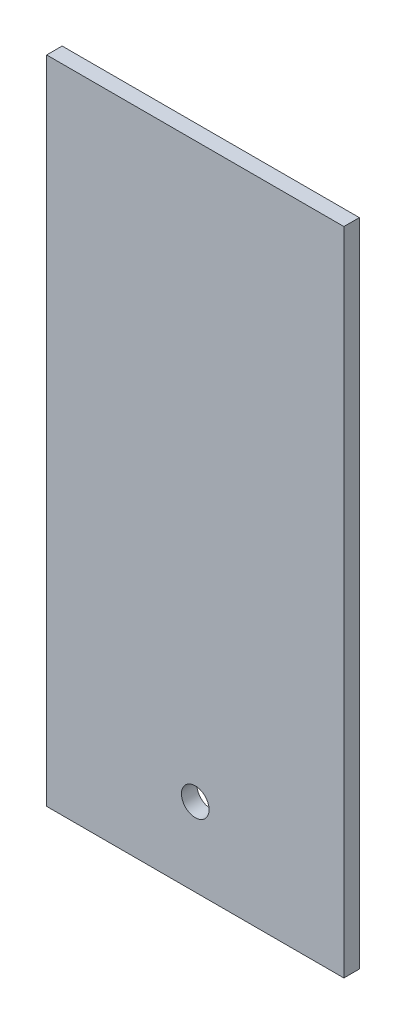
from build123d import *

# Parameters (mm, degrees)
ESBO_O1_W                = 117.8
ESBO_O1_H                = 53.8
RESSALTO_EXTRUS_O1_DEPTH = 1.4
ESBO_O2_R                = 2.5
CORTE_EXTRUS_O1_DEPTH    = 2.8


with BuildPart() as part:
    # Esboço1 → Ressalto-extrusão1 (new, symmetric)
    with BuildSketch(Plane(origin=(0, 0, 0), x_dir=(0, 1, 0), z_dir=(0, 0, 1))):
        Rectangle(ESBO_O1_W, ESBO_O1_H)
    extrude(amount=RESSALTO_EXTRUS_O1_DEPTH, both=True)

    # Esboço2 → Corte-extrusão1 (cut)
    with BuildSketch(Plane.XY.offset(1.4)):
        with Locations((0, -44.716913091)):
            Circle(ESBO_O2_R)
    extrude(amount=-CORTE_EXTRUS_O1_DEPTH, mode=Mode.SUBTRACT)


solid = part.part
